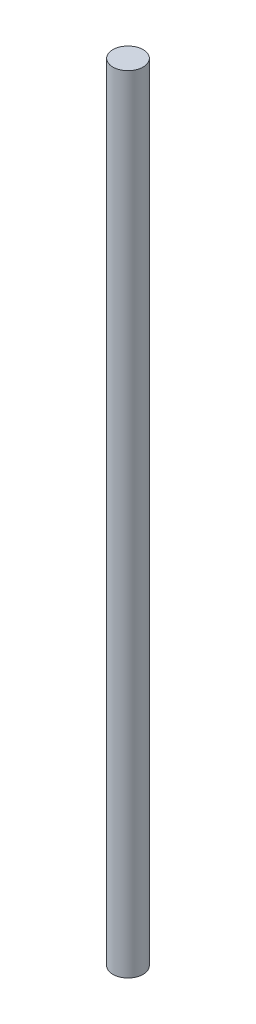
from build123d import *

# Parameters (mm, degrees)
SKETCH1_R           = 3.175
BOSS_EXTRUDE1_DEPTH = 165.1


with BuildPart() as part:
    # Sketch1 → Boss-Extrude1 (new body)
    with BuildSketch(Plane(origin=(0, 0, 0), x_dir=(1, 0, 0), z_dir=(0, 1, 0))):
        with Locations(Location((0, 0, 0), (0, 0, 270))):
            Circle(SKETCH1_R)
    extrude(amount=BOSS_EXTRUDE1_DEPTH)


solid = part.part
